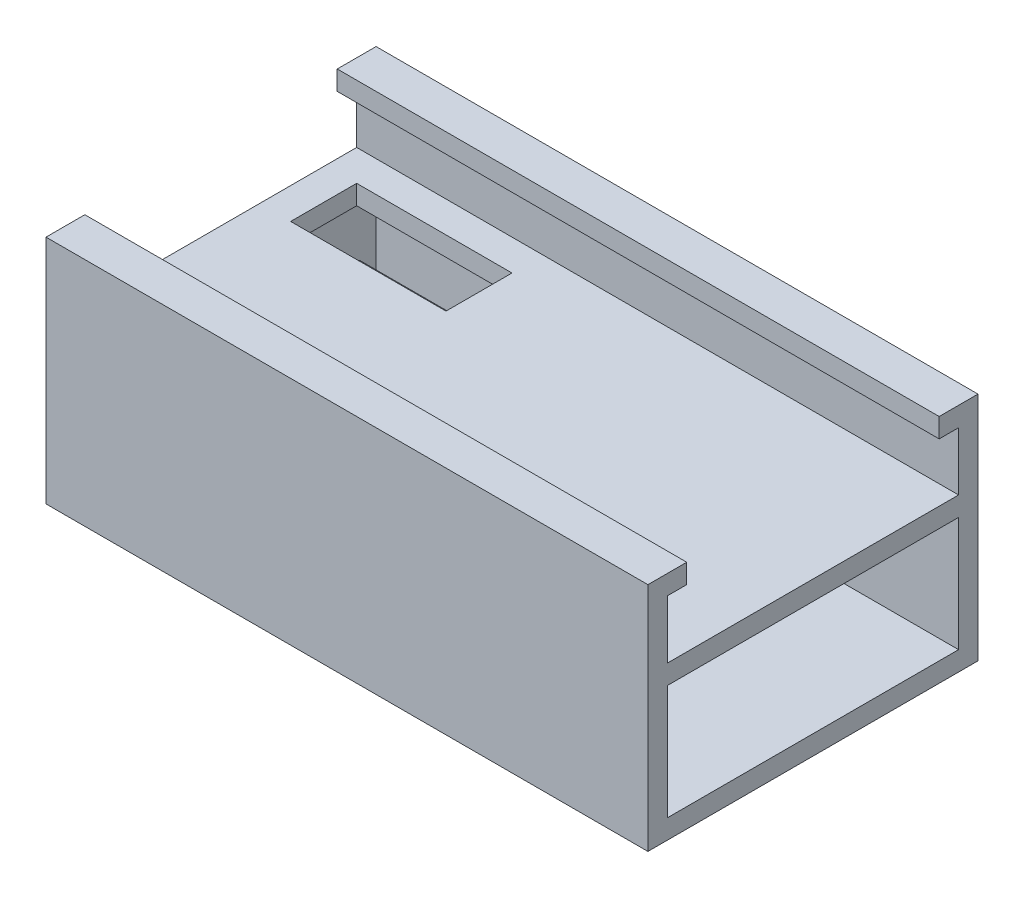
from build123d import *

# Parameters (mm, degrees)
SKETCH1_W            = 155
SKETCH1_H            = 85
BOSS_EXTRUDE1_DEPTH  = 5
SKETCH2_W            = 54
SKETCH2_H            = 35.4
BOSS_EXTRUDE19_DEPTH = 5
SKETCH14_W           = 5
SKETCH14_H           = 35.4
BOSS_EXTRUDE23_DEPTH = 9
SKETCH17_W           = 49
SKETCH17_H           = 4
BOSS_EXTRUDE24_DEPTH = 9
SKETCH18_W           = 49
SKETCH18_H           = 4.5
BOSS_EXTRUDE25_DEPTH = 5
SKETCH19_W           = 17.4
SKETCH19_H           = 4.5
BOSS_EXTRUDE26_DEPTH = 5
SKETCH20_W           = 49
SKETCH20_H           = 4
BOSS_EXTRUDE27_DEPTH = 9
SKETCH21_W           = 49
SKETCH21_H           = 4.5
BOSS_EXTRUDE28_DEPTH = 9
SKETCH24_W           = 40
SKETCH24_H           = 5.3
CUT_EXTRUDE3_DEPTH   = 9
SKETCH26_W           = 155
SKETCH26_H           = 5
BOSS_EXTRUDE29_DEPTH = 54.5
SKETCH27_W           = 155
SKETCH27_H           = 5
BOSS_EXTRUDE30_DEPTH = 75
SKETCH28_W           = 155
SKETCH28_H           = 5
BOSS_EXTRUDE31_DEPTH = 54.5
SKETCH29_W           = 75
SKETCH29_H           = 34.5
BOSS_EXTRUDE32_DEPTH = 5
SKETCH30_W           = 40
SKETCH30_H           = 17
CUT_EXTRUDE4_DEPTH   = 5
SKETCH31_W           = 27.4
SKETCH31_H           = 4.5
CUT_EXTRUDE6_DEPTH   = 5
SKETCH32_W           = 155
SKETCH32_H           = 5
BOSS_EXTRUDE33_DEPTH = 10
SKETCH33_W           = 155
SKETCH33_H           = 5
BOSS_EXTRUDE34_DEPTH = 10


with BuildPart() as part:
    # Sketch1 → Boss-Extrude1 (new body)
    with BuildSketch(Plane(origin=(0, 0, 0), x_dir=(1, 0, 0), z_dir=(0, 1, 0))):
        with Locations((48.537611559, -27.765767023)):
            Rectangle(SKETCH1_W, SKETCH1_H)
    extrude(amount=BOSS_EXTRUDE1_DEPTH)

    # Sketch2 → Boss-Extrude19 (add)
    with BuildSketch(Plane(origin=(0, 5, 0), x_dir=(1, 0, 0), z_dir=(0, 1, 0))):
        with Locations((3.037611559, -12.265767023)):
            Rectangle(SKETCH2_W, SKETCH2_H)
    extrude(amount=BOSS_EXTRUDE19_DEPTH)

    # Sketch14 → Boss-Extrude23 (add)
    with BuildSketch(Plane(origin=(0, 10, 0), x_dir=(1, 0, 0), z_dir=(0, 1, 0))):
        with Locations((27.537611559, -12.265767023)):
            Rectangle(SKETCH14_W, SKETCH14_H)
    extrude(amount=BOSS_EXTRUDE23_DEPTH)

    # Sketch17 → Boss-Extrude24 (add)
    with BuildSketch(Plane(origin=(0, 10, 0), x_dir=(1, 0, 0), z_dir=(0, 1, 0))):
        with Locations((0.537611559, 3.434232977)):
            Rectangle(SKETCH17_W, SKETCH17_H)
    extrude(amount=BOSS_EXTRUDE24_DEPTH)

    # Sketch18 → Boss-Extrude25 (add)
    with BuildSketch(Plane.XY.offset(-1.434232977)):
        with Locations((0.537611559, 16.75)):
            Rectangle(SKETCH18_W, SKETCH18_H)
    extrude(amount=BOSS_EXTRUDE25_DEPTH)

    # Sketch19 → Boss-Extrude26 (add)
    with BuildSketch(Plane.ZY.offset(-25.037611559)):
        with Locations((12.265767023, 16.75)):
            Rectangle(SKETCH19_W, SKETCH19_H)
    extrude(amount=BOSS_EXTRUDE26_DEPTH)

    # Sketch20 → Boss-Extrude27 (add)
    with BuildSketch(Plane(origin=(0, 10, 0), x_dir=(1, 0, 0), z_dir=(0, 1, 0))):
        with Locations((0.537611559, -27.965767023)):
            Rectangle(SKETCH20_W, SKETCH20_H)
    extrude(amount=BOSS_EXTRUDE27_DEPTH)

    # Sketch21 → Boss-Extrude28 (add)
    with BuildSketch(Plane.XY.offset(29.965767023)):
        with Locations((0.537611559, 16.75)):
            Rectangle(SKETCH21_W, SKETCH21_H)
    extrude(amount=-BOSS_EXTRUDE28_DEPTH)

    # Sketch24 → Cut-Extrude3 (cut)
    with BuildSketch(Plane(origin=(0, 19, 0), x_dir=(1, 0, 0), z_dir=(0, 1, 0))):
        with Locations((-0.962388441, -0.915767023)):
            Rectangle(SKETCH24_W, SKETCH24_H)
    extrude(amount=-CUT_EXTRUDE3_DEPTH, mode=Mode.SUBTRACT)

    # Sketch26 → Boss-Extrude29 (add)
    with BuildSketch(Plane(origin=(0, 5, 0), x_dir=(1, 0, 0), z_dir=(0, 1, 0))):
        with Locations((48.537611559, 12.234232977)):
            Rectangle(SKETCH26_W, SKETCH26_H)
    extrude(amount=BOSS_EXTRUDE29_DEPTH)

    # Sketch27 → Boss-Extrude30 (add)
    with BuildSketch(Plane.XY.offset(-9.734232977)):
        with Locations((48.537611559, 37)):
            Rectangle(SKETCH27_W, SKETCH27_H)
    extrude(amount=BOSS_EXTRUDE30_DEPTH)

    # Sketch28 → Boss-Extrude31 (add)
    with BuildSketch(Plane(origin=(0, 5, 0), x_dir=(1, 0, 0), z_dir=(0, 1, 0))):
        with Locations((48.537611559, -67.765767023)):
            Rectangle(SKETCH28_W, SKETCH28_H)
    extrude(amount=BOSS_EXTRUDE31_DEPTH)

    # Sketch29 → Boss-Extrude32 (add)
    with BuildSketch(Plane.ZY.offset(28.962388441)):
        with Locations((27.765767023, 22.25)):
            Rectangle(SKETCH29_W, SKETCH29_H)
    extrude(amount=-BOSS_EXTRUDE32_DEPTH)

    # Sketch30 → Cut-Extrude4 (cut)
    with BuildSketch(Plane(origin=(0, 39.5, 0), x_dir=(1, 0, 0), z_dir=(0, 1, 0))):
        with Locations((-0.962388441, -6.765767023)):
            Rectangle(SKETCH30_W, SKETCH30_H)
    extrude(amount=-CUT_EXTRUDE4_DEPTH, mode=Mode.SUBTRACT)

    # Sketch31 → Cut-Extrude6 (cut)
    with BuildSketch(Plane.ZY.offset(28.962388441)):
        with Locations((12.265767023, 12.25)):
            Rectangle(SKETCH31_W, SKETCH31_H)
    extrude(amount=-CUT_EXTRUDE6_DEPTH, mode=Mode.SUBTRACT)

    # Sketch32 → Boss-Extrude33 (add)
    with BuildSketch(Plane.XY.offset(70.265767023)):
        with Locations((48.537611559, 57)):
            Rectangle(SKETCH32_W, SKETCH32_H)
    extrude(amount=-BOSS_EXTRUDE33_DEPTH)

    # Sketch33 → Boss-Extrude34 (add)
    with BuildSketch(Plane(origin=(0, 0, -14.734232977), x_dir=(-1, 0, 0), z_dir=(0, 0, -1))):
        with Locations((-48.537611559, 57)):
            Rectangle(SKETCH33_W, SKETCH33_H)
    extrude(amount=-BOSS_EXTRUDE34_DEPTH)


solid = part.part
